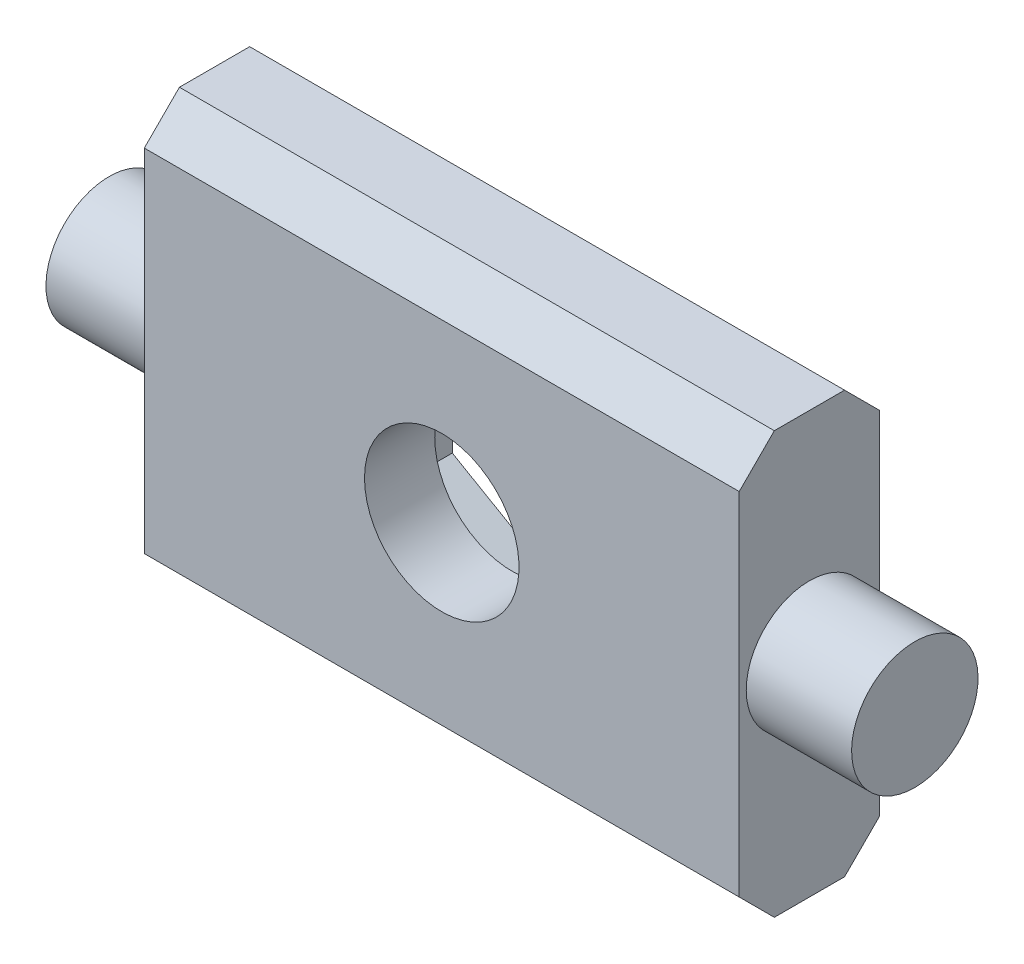
from build123d import *

# Parameters (mm, degrees)
SKETCH_1_W          = 22.94
SKETCH_1_H          = 12
EXTRUDE_1_DEPTH     = 4
CUT_EXTRUDE_1_DEPTH = 3
CUT_EXTRUDE_START   = -3
CUT_EXTRUDE_2_DEPTH = 3
CUT_EXTRUDE_4_DEPTH = 2
SKETCH_6_R          = 2
CUT_EXTRUDE_5_DEPTH = 14.548464858
CHAMFER_1_SIZE      = 1
CHAMFER_2_SIZE      = 1
CUT_EXTRUDE_START_2 = 10
SKETCH_7_R          = 2
SKETCH_7_R_2        = 1.8
CUT_EXTRUDE_6_DEPTH = 10
SKETCH_8_R          = 2
SKETCH_8_R_2        = 1.8
CUT_EXTRUDE_7_DEPTH = 3
SKETCH_9_R          = 2.2
CUT_EXTRUDE_8_DEPTH = 14.548464858
CUT_EXTRUDE_9_DEPTH = 2


with BuildPart() as part:
    # Эскиз1 → Бобышка-Вытянуть1 (new body)
    with BuildSketch(Plane.XY):
        Rectangle(SKETCH_1_W, SKETCH_1_H)
    extrude(amount=EXTRUDE_1_DEPTH)

    # Эскиз3 → Вырез-Вытянуть1 (cut)
    with BuildSketch(Plane(origin=(11.47, 0, 0), x_dir=(0, 0, -1), z_dir=(1, 0, 0))):
        with BuildLine():
            ThreePointArc((-4, 0), (-2, 2), (0, 0))
            Line((0, 0), (0, 6))
            Line((0, 6), (-4, 6))
            Line((-4, 6), (-4, 0))
        make_face()
        with BuildLine():
            Line((-4, -6), (0, -6))
            Line((0, -6), (0, 0))
            ThreePointArc((0, 0), (-2, -2), (-4, 0))
            Line((-4, 0), (-4, -6))
        make_face()
    extrude(amount=-CUT_EXTRUDE_1_DEPTH, mode=Mode.SUBTRACT)

    # Эскиз4 → Вырез-Вытянуть2 (cut)
    with BuildSketch(Plane.ZY.offset(11.47).offset(CUT_EXTRUDE_START)):
        with BuildLine():
            Line((4, 6), (0, 6))
            Line((0, 6), (0, 0))
            ThreePointArc((0, 0), (2, 2), (4, 0))
            Line((4, 0), (4, 6))
        make_face()
        with BuildLine():
            ThreePointArc((4, 0), (2, -2), (0, 0))
            Line((0, 0), (0, -6))
            Line((0, -6), (4, -6))
            Line((4, -6), (4, 0))
        make_face()
    extrude(amount=CUT_EXTRUDE_2_DEPTH, mode=Mode.SUBTRACT)

    # Эскиз5 → Вырез-Вытянуть4 (cut)
    with BuildSketch(Plane(origin=(0, 0, 0), x_dir=(-1, 0, 0), z_dir=(0, 0, -1))):
        Polygon((0, -4.041451884), (3.5, -2.020725942), (3.5, 2.020725942), (0, 4.041451884), (-3.5, 2.020725942), (-3.5, -2.020725942), align=None)
    extrude(amount=-CUT_EXTRUDE_4_DEPTH, mode=Mode.SUBTRACT)

    # Эскиз6 → Вырез-Вытянуть5 (cut, through all)
    with BuildSketch(Plane(origin=(0, 0, 0), x_dir=(-1, 0, 0), z_dir=(0, 0, -1))):
        Circle(SKETCH_6_R)
    extrude(amount=-CUT_EXTRUDE_5_DEPTH, mode=Mode.SUBTRACT)

    # Фаска1
    chamfer_1_edges = [part.edges().sort_by_distance(p)[0] for p in [
        (0, 6, 0),
    ]]
    chamfer(chamfer_1_edges, length=CHAMFER_1_SIZE)

    # Фаска2
    chamfer_2_edges = [part.edges().sort_by_distance(p)[0] for p in [
        (0, 6, 4),
        (0, -6, 4),
        (0, -6, 0),
    ]]
    chamfer(chamfer_2_edges, length=CHAMFER_2_SIZE)

    # Эскиз7 → Вырез-Вытянуть6 (cut)
    with BuildSketch(Plane(origin=(8.47, 0, 0), x_dir=(0, 0, -1), z_dir=(1, 0, 0)).offset(CUT_EXTRUDE_START_2)):
        with Locations(Location((-2, 0, 0), (0, 0, 270))):
            Circle(SKETCH_7_R)
        with Locations(Location((-2, 0, 0), (0, 0, 270))):
            Circle(SKETCH_7_R_2, mode=Mode.SUBTRACT)
    extrude(amount=-CUT_EXTRUDE_6_DEPTH, mode=Mode.SUBTRACT)

    # Эскиз8 → Вырез-Вытянуть7 (cut)
    with BuildSketch(Plane.ZY.offset(11.47).offset(CUT_EXTRUDE_START)):
        with Locations((2, 0)):
            Circle(SKETCH_8_R)
        with Locations(Location((2, 0, 0), (0, 0, 270))):
            Circle(SKETCH_8_R_2, mode=Mode.SUBTRACT)
    extrude(amount=CUT_EXTRUDE_7_DEPTH, mode=Mode.SUBTRACT)

    # Эскиз9 → Вырез-Вытянуть8 (cut, through all)
    with BuildSketch(Plane(origin=(0, 0, 0), x_dir=(-1, 0, 0), z_dir=(0, 0, -1))):
        Circle(SKETCH_9_R)
    extrude(amount=-CUT_EXTRUDE_8_DEPTH, mode=Mode.SUBTRACT)

    # Эскиз10 → Вырез-Вытянуть9 (cut)
    with BuildSketch(Plane(origin=(0, 0, 0), x_dir=(-1, 0, 0), z_dir=(0, 0, -1))):
        Polygon((0, -4.272391992), (3.7, -2.136195996), (3.7, 2.136195996), (0, 4.272391992), (-3.7, 2.136195996), (-3.7, -2.136195996), align=None)
    extrude(amount=-CUT_EXTRUDE_9_DEPTH, mode=Mode.SUBTRACT)


solid = part.part
